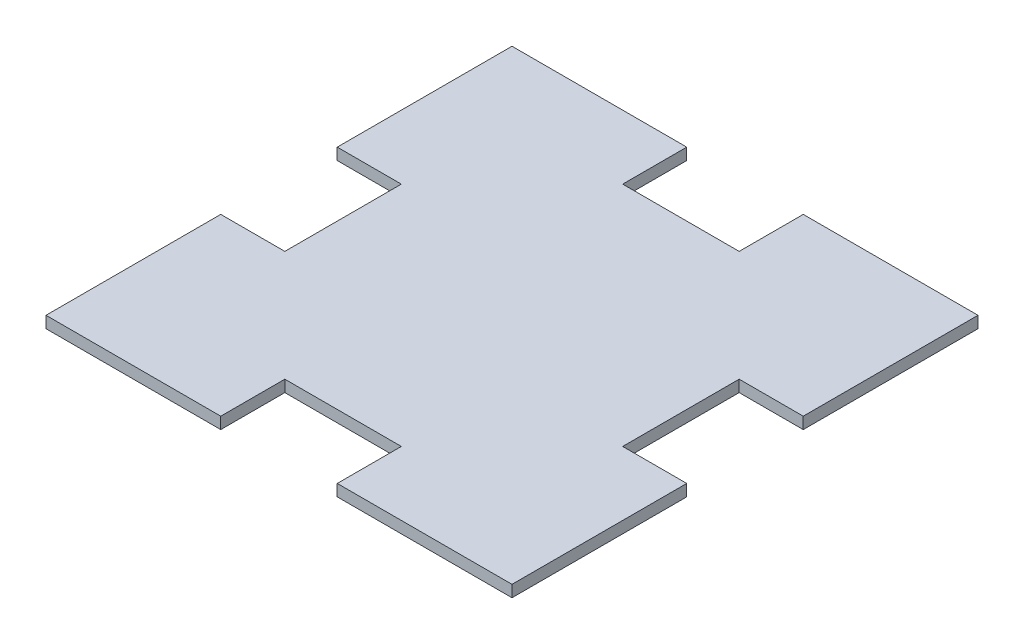
from build123d import *

# Parameters (mm, degrees)
BOSS_EXTRUDE1_DEPTH = 6.35


with BuildPart() as part:
    # Sketch1 → Boss-Extrude1 (new body)
    with BuildSketch(Plane(origin=(0, 0, 0), x_dir=(1, 0, 0), z_dir=(0, 1, 0))):
        Polygon((-127, -25.511858386), (-127, -120.761858386), (-31.75, -120.761858386), (-31.75, -85.836858386), (31.75, -85.836858386), (31.75, -120.761858386), (127, -120.761858386), (127, -25.511858386), (92.075, -25.511858386), (92.075, 37.988141614), (127, 37.988141614), (127, 133.238141614), (31.75, 133.238141614), (31.75, 98.313141614), (-31.75, 98.313141614), (-31.75, 133.238141614), (-127, 133.238141614), (-127, 37.988141614), (-92.075, 37.988141614), (-92.075, -25.511858386), align=None)
    extrude(amount=BOSS_EXTRUDE1_DEPTH)


solid = part.part
